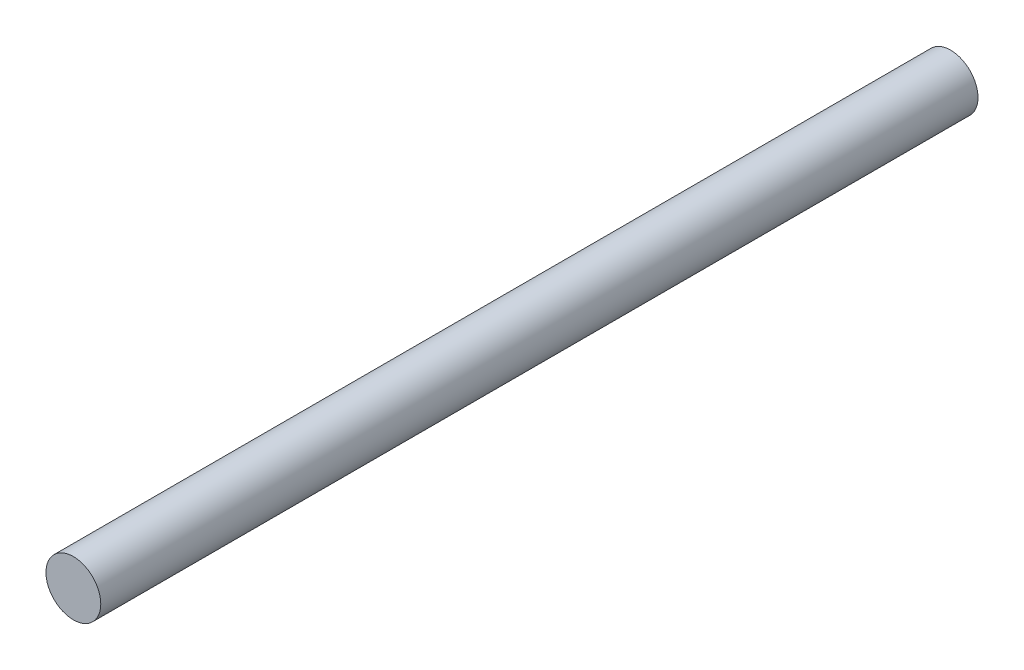
from build123d import *

# Parameters (mm, degrees)
SKETCH_1_R      = 2.5
EXTRUDE_1_DEPTH = 80


with BuildPart() as part:
    # Эскиз1 → Вытянуть1 (new body)
    with BuildSketch(Plane.XY):
        Circle(SKETCH_1_R)
    extrude(amount=EXTRUDE_1_DEPTH)


solid = part.part
